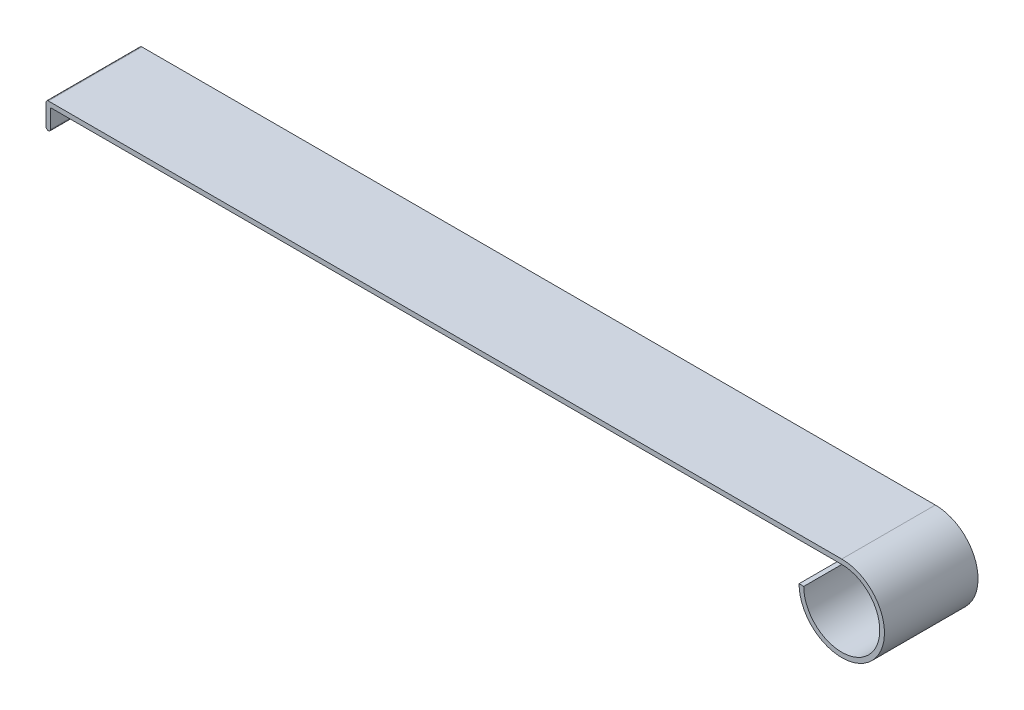
from build123d import *

# Parameters (mm, degrees)
RESSALTO_EXTRUS_O1_DEPTH = 4


with BuildPart() as part:
    # Esboço1 → Ressalto-extrusão1 (new body)
    with BuildSketch(Plane.XY):
        with BuildLine():
            Line((0.1, 0), (0.1, 0.8))
            Line((0.1, 0.8), (33.077498183, 0.8))
            Line((33.077498183, 0.8), (33.908082875, 0.8))
            ThreePointArc((33.908082875, 0.8), (35.05690323, -1.973497683), (32.283405548, -0.824677327))
            Line((32.283405548, -0.824677327), (32.083405548, -0.824677327))
            ThreePointArc((32.083405548, -0.824677327), (35.198324587, -2.114919039), (33.908082875, 1))
            Line((33.908082875, 1), (0, 1))
            ThreePointArc((0, 1), (-0.070710678, 0.970710678), (-0.1, 0.9))
            Line((-0.1, 0.9), (-0.1, 0.8))
            Line((-0.1, 0.8), (-0.1, 0))
            ThreePointArc((-0.1, 0), (0, -0.1), (0.1, 0))
        make_face()
    extrude(amount=RESSALTO_EXTRUS_O1_DEPTH)


solid = part.part
